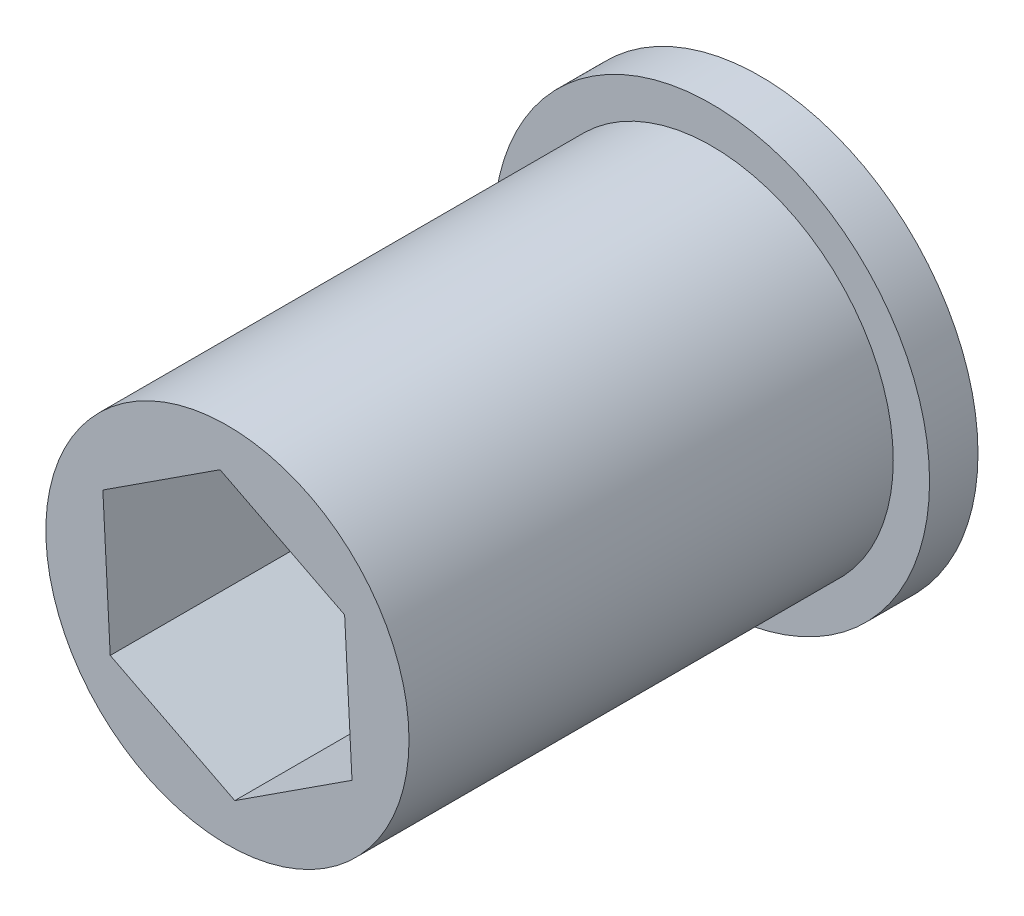
from build123d import *

# Parameters (mm, degrees)
SKETCH1_R           = 9.525
BOSS_EXTRUDE1_DEPTH = 27.94
SKETCH1_5_R         = 11.43
SKETCH1_5_R_2       = 9.525
BOSS_EXTRUDE2_DEPTH = 2.54


with BuildPart() as part:
    # Sketch1 → Boss-Extrude1 (new body)
    with BuildSketch(Plane.XY):
        Circle(SKETCH1_R)
        Polygon((-0.386795664, 7.322139199), (6.147760724, 3.996044471), (6.534556388, -3.326094728), (0.386795664, -7.322139199), (-6.147760724, -3.996044471), (-6.534556388, 3.326094728), align=None, mode=Mode.SUBTRACT)
    extrude(amount=BOSS_EXTRUDE1_DEPTH)

    # Sketch1<5> → Boss-Extrude2 (add)
    with BuildSketch(Plane.XY):
        Circle(SKETCH1_5_R)
        Circle(SKETCH1_5_R_2, mode=Mode.SUBTRACT)
    extrude(amount=BOSS_EXTRUDE2_DEPTH)


solid = part.part
